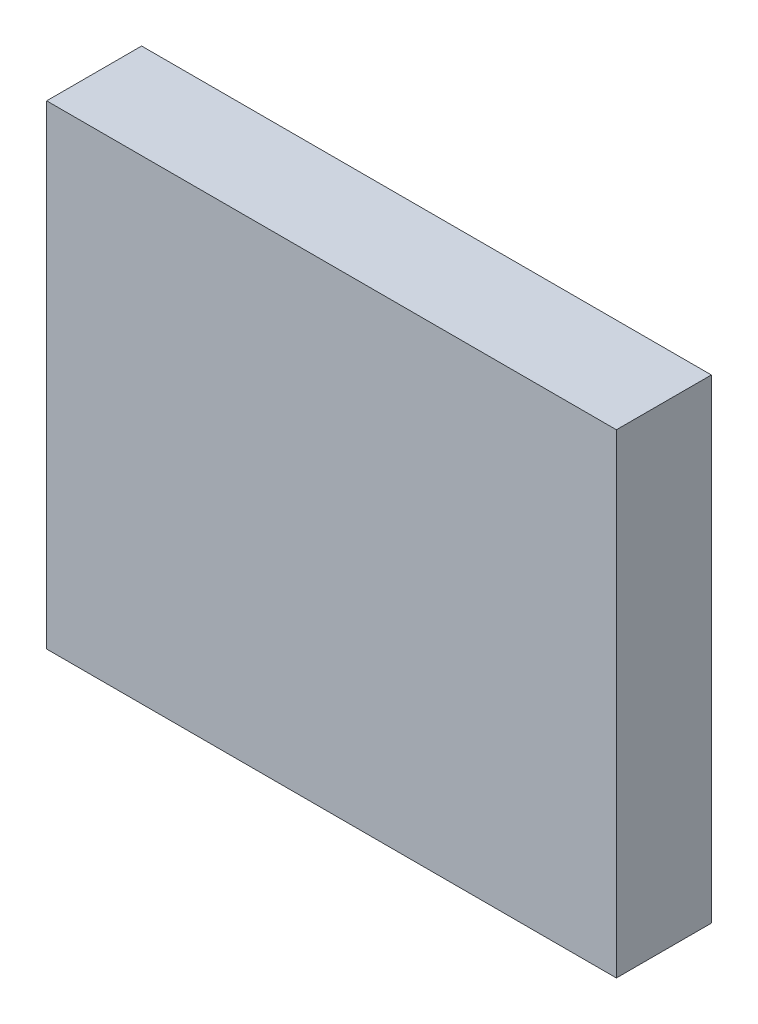
from build123d import *

# Parameters (mm, degrees)
CROQUIS1_W              = 60
CROQUIS1_H              = 50
SALIENTE_EXTRUIR1_DEPTH = 10


with BuildPart() as part:
    # Croquis1 → Saliente-Extruir1 (new body)
    with BuildSketch(Plane.XY):
        Rectangle(CROQUIS1_W, CROQUIS1_H)
    extrude(amount=SALIENTE_EXTRUIR1_DEPTH)


solid = part.part
